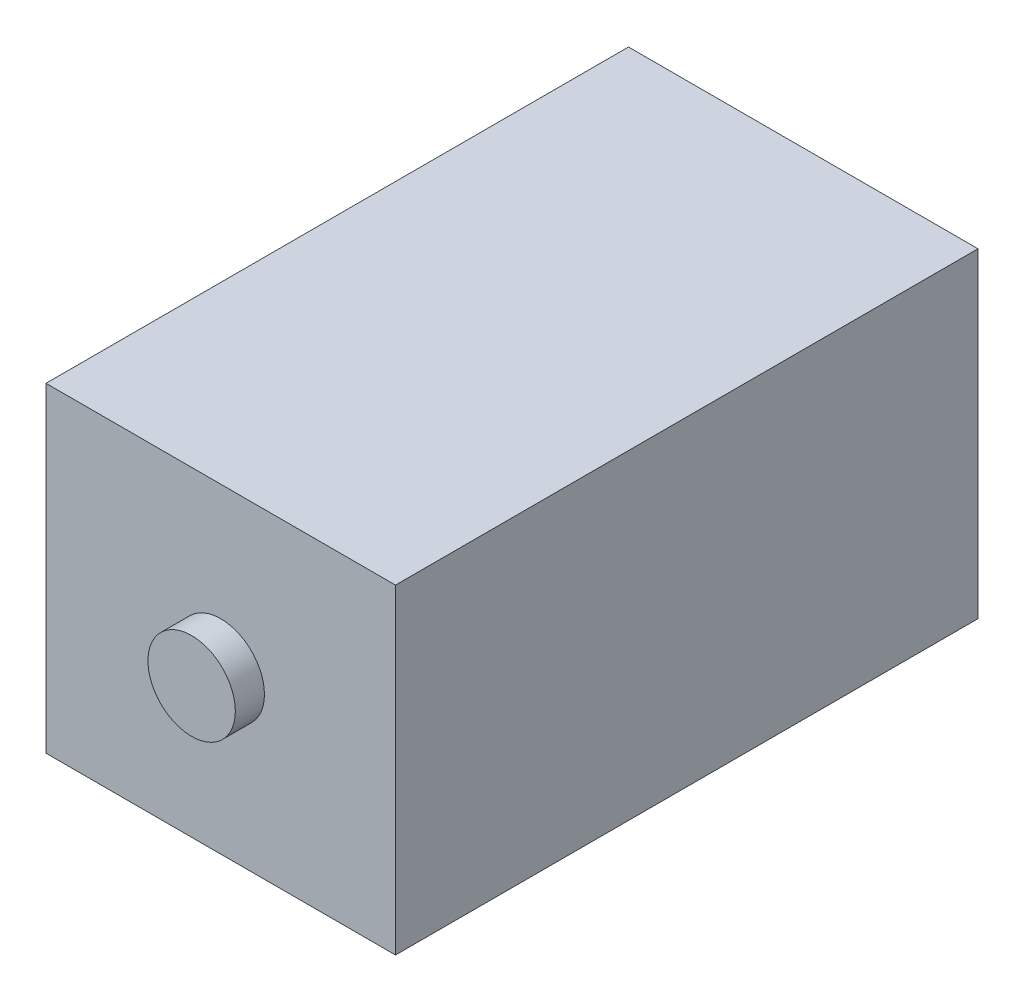
from build123d import *

# Parameters (mm, degrees)
SKETCH_1_W      = 12
SKETCH_1_H      = 11
EXTRUDE_1_DEPTH = 20
SKETCH_2_R      = 1.5
EXTRUDE_2_DEPTH = 1


with BuildPart() as part:
    # ｽｹｯﾁ1 → ﾎﾞｽ - 押し出し1 (new body)
    with BuildSketch(Plane.XY):
        Rectangle(SKETCH_1_W, SKETCH_1_H)
    extrude(amount=EXTRUDE_1_DEPTH)

    # ｽｹｯﾁ2 → ﾎﾞｽ - 押し出し2 (add)
    with BuildSketch(Plane.XY.offset(20)):
        Circle(SKETCH_2_R)
    extrude(amount=EXTRUDE_2_DEPTH)


solid = part.part
